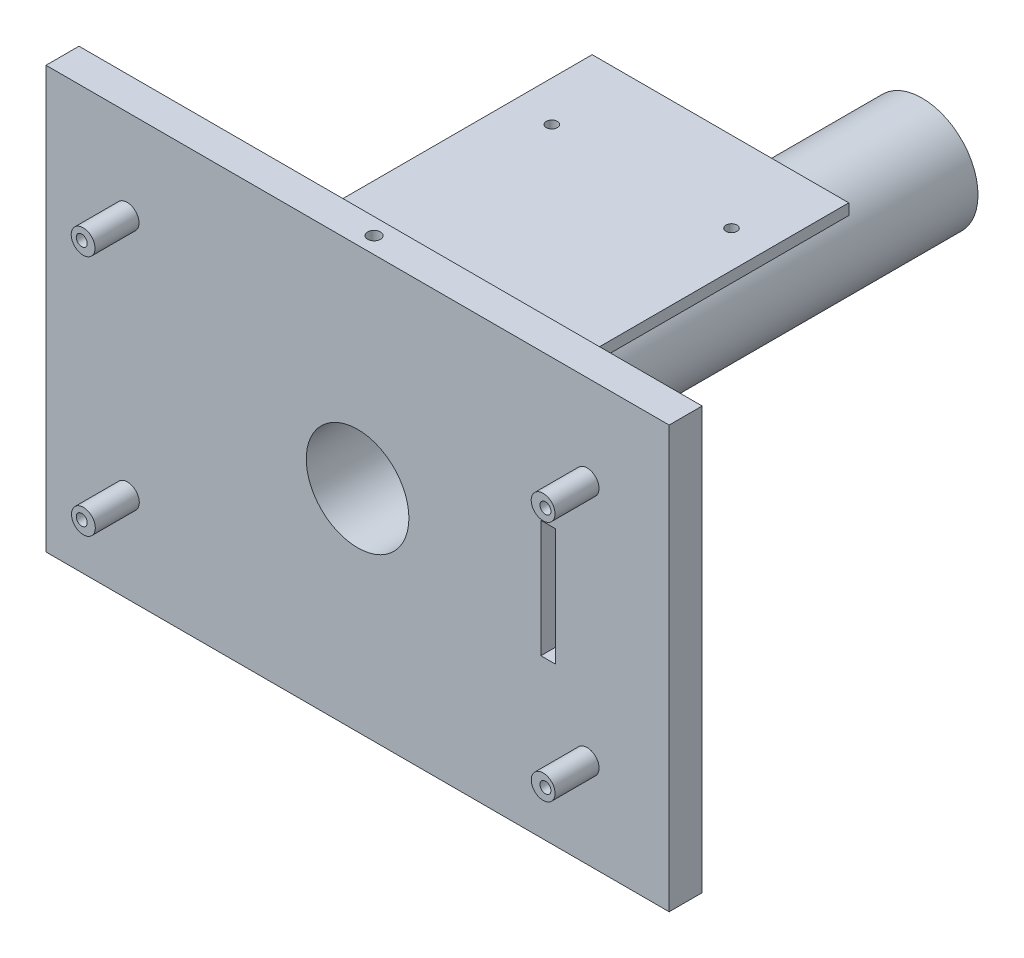
from build123d import *

# Parameters (mm, degrees)
ESQUISSE1_R                         = 15.25
ESQUISSE1_R_2                       = 13.5
BOSS_EXTRU_1_DEPTH                  = 145
ENL_V_MAT_EXTRU_1_REACH             = 148.595
ESQUISSE4_R                         = 2
ENL_V_MAT_EXTRU_1_DIRECTION_2_DEPTH = 147.595105648
ESQUISSE5_W                         = 170
ESQUISSE5_H                         = 115
BOSS_EXTRU_2_DEPTH                  = 9
ESQUISSE14_R                        = 14
ENL_V_MAT_EXTRU_2_DEPTH             = 186.060125365
ENL_V_MAT_EXTRU_3_DEPTH             = 186.060125448
ENL_V_MAT_EXTRU_3_DEPTH_BACK        = 186.060125448
ESQUISSE15_R                        = 1.5
ESQUISSE16_R                        = 1.75
ENL_V_MAT_EXTRU_4_DEPTH             = 15
ESQUISSE22_W                        = 70
ESQUISSE22_H                        = 3
BOSS_EXTRU_11_DEPTH                 = 90
ENL_V_MAT_EXTRU_6_DEPTH             = 90
ESQUISSE25_W                        = 4
ESQUISSE25_H                        = 32
ENL_V_MAT_EXTRU_7_DEPTH             = 90
ENL_V_MAT_EXTRU_8_REACH             = 187.06
ENL_V_MAT_EXTRU_8_END_RADIUS        = 15.25
ESQUISSE26_W                        = 15.960277927
ESQUISSE26_H                        = 17.240886996
ESQUISSE27_R                        = 3.25
BOSS_EXTRU_12_DEPTH                 = 12
ENL_V_MAT_EXTRU_9_DEPTH             = 178.640789317


with BuildPart() as part:
    # Esquisse1 → Boss.-Extru.1 (new body)
    with BuildSketch(Plane.XY):
        Circle(ESQUISSE1_R)
        Circle(ESQUISSE1_R_2, mode=Mode.SUBTRACT)
    extrude(amount=BOSS_EXTRU_1_DEPTH)

    # Esquisse4 → Enlèv. mat.-Extru.1 (cut, up to next)
    with BuildSketch(Plane(origin=(0, 0, 0), x_dir=(1, 0, 0), z_dir=(0, 1, 0)), mode=Mode.PRIVATE) as enl_v_mat_extru_1_sk1:
        with Locations(Location((0, -52.5, 0), (0, 0, 270))):
            Circle(ESQUISSE4_R)
    enl_v_mat_extru_1_tool1 = extrude(enl_v_mat_extru_1_sk1.sketch, amount=-ENL_V_MAT_EXTRU_1_REACH, mode=Mode.PRIVATE) & part.part
    add(enl_v_mat_extru_1_tool1.solids().sort_by_distance((0, 0, 52.5))[0], mode=Mode.SUBTRACT)

    # Esquisse4 → Enlèv. mat.-Extru.1 direction 2 (cut)
    with BuildSketch(Plane(origin=(0, 0, 0), x_dir=(1, 0, 0), z_dir=(0, 1, 0))):
        with Locations(Location((0, -52.5, 0), (0, 0, 270))):
            Circle(ESQUISSE4_R)
    extrude(amount=ENL_V_MAT_EXTRU_1_DIRECTION_2_DEPTH, mode=Mode.SUBTRACT)

    # Esquisse5 → Boss.-Extru.2 (add)
    with BuildSketch(Plane.XY.offset(145)):
        Rectangle(ESQUISSE5_W, ESQUISSE5_H)
    extrude(amount=BOSS_EXTRU_2_DEPTH)

    # Esquisse14 → Enlèv. mat.-Extru.2 (cut, through all)
    with BuildSketch(Plane.XY):
        Circle(ESQUISSE14_R)
    extrude(amount=ENL_V_MAT_EXTRU_2_DEPTH, mode=Mode.SUBTRACT)

    # Esquisse15 → Enlèv. mat.-Extru.3 (cut, two sides: drawn at the far end of the back side and taken through both)
    with BuildSketch(Plane.XY.offset(154).offset(-ENL_V_MAT_EXTRU_3_DEPTH_BACK)):
        with Locations((-63.25, 33)):
            Circle(ESQUISSE15_R)
        with Locations((63.25, 33)):
            Circle(ESQUISSE15_R)
        with Locations((63.25, -33)):
            Circle(ESQUISSE15_R)
        with Locations((-63.25, -33)):
            Circle(ESQUISSE15_R)
    extrude(amount=ENL_V_MAT_EXTRU_3_DEPTH + ENL_V_MAT_EXTRU_3_DEPTH_BACK, mode=Mode.SUBTRACT)

    # Esquisse16 → Enlèv. mat.-Extru.4 (cut)
    with BuildSketch(Plane(origin=(0, 57.5, 0), x_dir=(1, 0, 0), z_dir=(0, 1, 0))):
        with Locations(Location((0, -149.5, 0), (0, 0, 270))):
            Circle(ESQUISSE16_R)
    extrude(amount=-ENL_V_MAT_EXTRU_4_DEPTH, mode=Mode.SUBTRACT)

    # Esquisse22 → Boss.-Extru.11 (add)
    with BuildSketch(Plane(origin=(0, 0, 145), x_dir=(-1, 0, 0), z_dir=(0, 0, -1))):
        with Locations((0, 34)):
            Rectangle(ESQUISSE22_W, ESQUISSE22_H)
    extrude(amount=BOSS_EXTRU_11_DEPTH)

    # Esquisse23 → Enlèv. mat.-Extru.6 (cut)
    with BuildSketch(Plane(origin=(0, 35.5, 0), x_dir=(1, 0, 0), z_dir=(0, 1, 0))):
        with BuildLine():
            ThreePointArc((26.5, -135), (26.060660172, -133.939339828), (25, -133.5))
            Line((25, -133.5), (25, -135))
            Line((25, -135), (23.5, -135))
            ThreePointArc((23.5, -135), (25, -136.5), (26.5, -135))
        make_face()
        with BuildLine():
            Line((25, -135), (25, -133.5))
            ThreePointArc((25, -133.5), (23.939339828, -133.939339828), (23.5, -135))
            Line((23.5, -135), (25, -135))
        make_face()
        with BuildLine():
            ThreePointArc((-22.5, -135), (-22.939339828, -133.939339828), (-24, -133.5))
            Line((-24, -133.5), (-24, -135))
            Line((-24, -135), (-22.5, -135))
        make_face()
        with BuildLine():
            Line((-24, -135), (-24, -133.5))
            ThreePointArc((-24, -133.5), (-25.060660172, -136.060660172), (-22.5, -135))
            Line((-22.5, -135), (-24, -135))
        make_face()
        with BuildLine():
            ThreePointArc((26.5, -77), (25, -75.5), (23.5, -77))
            Line((23.5, -77), (25, -77))
            Line((25, -77), (25, -78.5))
            ThreePointArc((25, -78.5), (26.060660172, -78.060660172), (26.5, -77))
        make_face()
        with BuildLine():
            Line((25, -77), (23.5, -77))
            ThreePointArc((23.5, -77), (23.939339828, -78.060660172), (25, -78.5))
            Line((25, -78.5), (25, -77))
        make_face()
        with BuildLine():
            ThreePointArc((-24, -78.5), (-22.939339828, -78.060660172), (-22.5, -77))
            Line((-22.5, -77), (-24, -77))
            Line((-24, -77), (-24, -78.5))
        make_face()
        with BuildLine():
            Line((-24, -77), (-22.5, -77))
            ThreePointArc((-22.5, -77), (-25.060660172, -75.939339828), (-24, -78.5))
            Line((-24, -78.5), (-24, -77))
        make_face()
    extrude(amount=-ENL_V_MAT_EXTRU_6_DEPTH, mode=Mode.SUBTRACT)

    # Esquisse25 → Enlèv. mat.-Extru.7 (cut)
    with BuildSketch(Plane(origin=(0, 0, 145), x_dir=(-1, 0, 0), z_dir=(0, 0, -1))):
        with Locations((-52, 1.5)):
            Rectangle(ESQUISSE25_W, ESQUISSE25_H)
    extrude(amount=-ENL_V_MAT_EXTRU_7_DEPTH, mode=Mode.SUBTRACT)

    # Enlèv. mat.-Extru.8: up to this cylinder (the profile starts inside it)
    enl_v_mat_extru_8_end = Plane(origin=(0, 0, 68.486818), z_dir=(0, 0, -1)) * Cylinder(ENL_V_MAT_EXTRU_8_END_RADIUS, 405.62, mode=Mode.PRIVATE)
    # Esquisse26 → Enlèv. mat.-Extru.8 (cut, up to the surface)
    with BuildSketch(Plane(origin=(0, 0, 0), x_dir=(1, 0, 0), z_dir=(0, 1, 0)), mode=Mode.PRIVATE) as enl_v_mat_extru_8_sk1:
        with Locations((-0.793346945, -68.486817672)):
            Rectangle(ESQUISSE26_W, ESQUISSE26_H)
    enl_v_mat_extru_8_tool1 = extrude(enl_v_mat_extru_8_sk1.sketch, amount=ENL_V_MAT_EXTRU_8_REACH, mode=Mode.PRIVATE) & enl_v_mat_extru_8_end
    add(enl_v_mat_extru_8_tool1.solids().sort_by_distance((-0.793347, 0, 68.486818))[0], mode=Mode.SUBTRACT)

    # Esquisse27 → Boss.-Extru.12 (add)
    with BuildSketch(Plane.XY.offset(154)):
        with Locations((62.616003653, 32.933842855)):
            Circle(ESQUISSE27_R)
        with Locations((62.622273681, -33.123005587)):
            Circle(ESQUISSE27_R)
        with Locations((-62.800064313, -33.084450181)):
            Circle(ESQUISSE27_R)
        with Locations((-62.872546265, 32.930245113)):
            Circle(ESQUISSE27_R)
    extrude(amount=BOSS_EXTRU_12_DEPTH)

    # Esquisse29 → Enlèv. mat.-Extru.9 (cut, through all)
    with BuildSketch(Plane(origin=(0, 0, 145), x_dir=(-1, 0, 0), z_dir=(0, 0, -1))):
        with BuildLine():
            ThreePointArc((64.75, 33), (63.25, 34.5), (61.75, 33))
            Line((61.75, 33), (63.25, 33))
            Line((63.25, 33), (63.25, 31.5))
            ThreePointArc((63.25, 31.5), (64.310660172, 31.939339828), (64.75, 33))
        make_face()
        with BuildLine():
            Line((63.25, 33), (61.75, 33))
            ThreePointArc((61.75, 33), (62.189339828, 31.939339828), (63.25, 31.5))
            Line((63.25, 31.5), (63.25, 33))
        make_face()
        with BuildLine():
            ThreePointArc((64.75, -33), (64.310660172, -31.939339828), (63.25, -31.5))
            Line((63.25, -31.5), (63.25, -33))
            Line((63.25, -33), (61.75, -33))
            ThreePointArc((61.75, -33), (63.25, -34.5), (64.75, -33))
        make_face()
        with BuildLine():
            Line((63.25, -33), (63.25, -31.5))
            ThreePointArc((63.25, -31.5), (62.189339828, -31.939339828), (61.75, -33))
            Line((61.75, -33), (63.25, -33))
        make_face()
        with BuildLine():
            Line((-63.25, 31.5), (-63.25, 33))
            Line((-63.25, 33), (-61.75, 33))
            ThreePointArc((-61.75, 33), (-64.310660172, 34.060660172), (-63.25, 31.5))
        make_face()
        with BuildLine():
            Line((-61.75, 33), (-63.25, 33))
            Line((-63.25, 33), (-63.25, 31.5))
            ThreePointArc((-63.25, 31.5), (-62.189339828, 31.939339828), (-61.75, 33))
        make_face()
        with BuildLine():
            ThreePointArc((-61.75, -33), (-62.189339828, -31.939339828), (-63.25, -31.5))
            Line((-63.25, -31.5), (-63.25, -33))
            Line((-63.25, -33), (-61.75, -33))
        make_face()
        with BuildLine():
            Line((-63.25, -33), (-63.25, -31.5))
            ThreePointArc((-63.25, -31.5), (-64.310660172, -34.060660172), (-61.75, -33))
            Line((-61.75, -33), (-63.25, -33))
        make_face()
    extrude(amount=-ENL_V_MAT_EXTRU_9_DEPTH, mode=Mode.SUBTRACT)


solid = part.part
